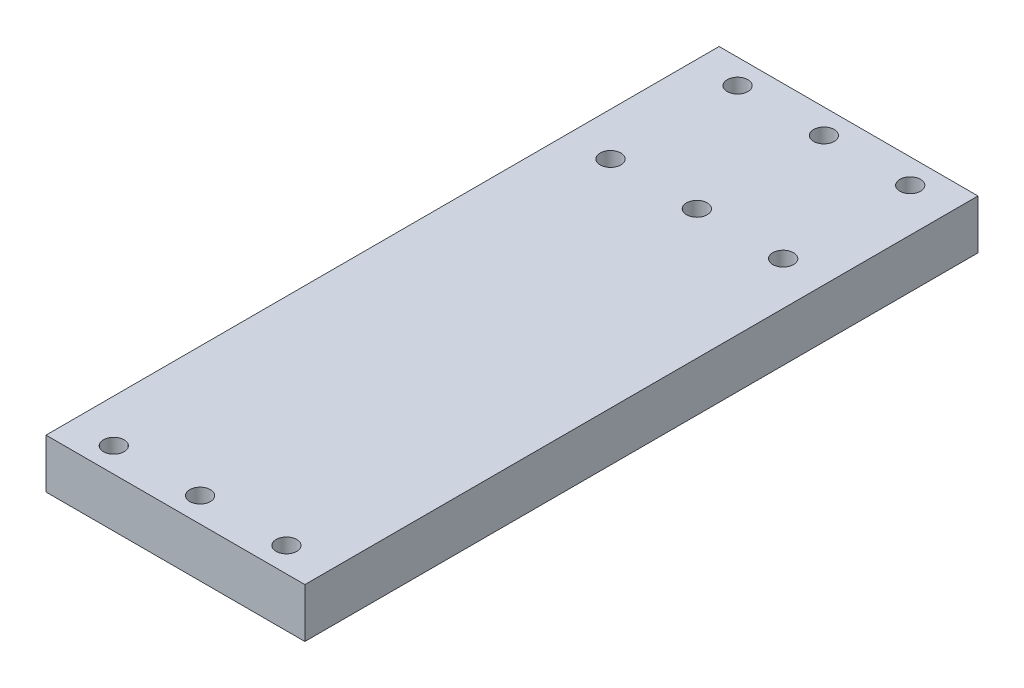
from build123d import *

# Parameters (mm, degrees)
SKETCH1_W             = 50
SKETCH1_H             = 130
BOSS_EXTRUDE1_DEPTH   = 9.525
F_4_0MM_DOWEL_HOLE1_D = 4


with BuildPart() as part:
    # Sketch1 → Boss-Extrude1 (new body)
    with BuildSketch(Plane(origin=(0, 0, 0), x_dir=(1, 0, 0), z_dir=(0, 1, 0))):
        Rectangle(SKETCH1_W, SKETCH1_H)
    extrude(amount=BOSS_EXTRUDE1_DEPTH)

    # Ø4.0mm Dowel Hole1 (through all)
    with Locations(Plane.XZ):
        with Locations((-16.67, -60.2375), (-16.67, -35.7), (0, -35.7), (16.67, -35.7), (16.67, 60.2375), (0, 60.2375), (-16.67, 60.2375), (16.67, -60.2375), (0, -60.2375)):
            Hole(F_4_0MM_DOWEL_HOLE1_D / 2)


solid = part.part
